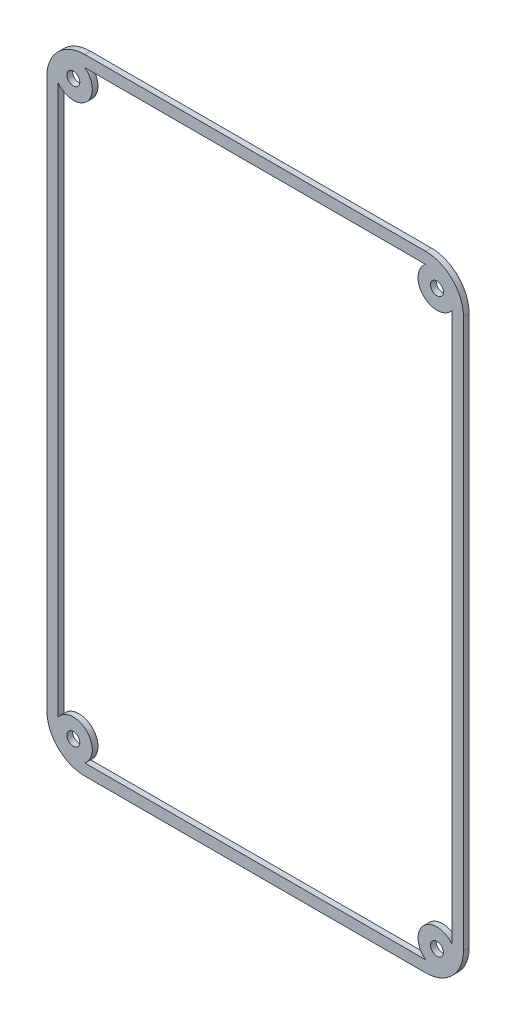
from build123d import *

# Parameters (mm, degrees)
BOSS_EXTRUDE1_DEPTH = 1.5
SKETCH2_R           = 5
BOSS_EXTRUDE2_DEPTH = 1.5
SKETCH3_R           = 1.7
CUT_EXTRUDE1_DEPTH  = 100.164005567


with BuildPart() as part:
    # Sketch1 → Boss-Extrude1 (new body)
    with BuildSketch(Plane.XY):
        with BuildLine():
            Line((-45, -82.5), (45, -82.5))
            ThreePointArc((45, -82.5), (52.071067812, -79.571067812), (55, -72.5))
            Line((55, -72.5), (55, 72.5))
            ThreePointArc((55, 72.5), (52.071067812, 79.571067812), (45, 82.5))
            Line((45, 82.5), (-45, 82.5))
            ThreePointArc((-45, 82.5), (-52.071067812, 79.571067812), (-55, 72.5))
            Line((-55, 72.5), (-55, -72.5))
            ThreePointArc((-55, -72.5), (-52.071067812, -79.571067812), (-45, -82.5))
        make_face()
        with BuildLine():
            Line((-45, -79.5), (45, -79.5))
            ThreePointArc((45, -79.5), (49.949747468, -77.449747468), (52, -72.5))
            Line((52, -72.5), (52, 72.5))
            ThreePointArc((52, 72.5), (49.949747468, 77.449747468), (45, 79.5))
            Line((45, 79.5), (-45, 79.5))
            ThreePointArc((-45, 79.5), (-49.949747468, 77.449747468), (-52, 72.5))
            Line((-52, 72.5), (-52, -72.5))
            ThreePointArc((-52, -72.5), (-49.949747468, -77.449747468), (-45, -79.5))
        make_face(mode=Mode.SUBTRACT)
    extrude(amount=BOSS_EXTRUDE1_DEPTH)

    # Sketch2 → Boss-Extrude2 (add)
    with BuildSketch(Plane.XY):
        with Locations((-48, -75.5)):
            Circle(SKETCH2_R)
        with Locations((-48, 75.5)):
            Circle(SKETCH2_R)
        with Locations((48, -75.5)):
            Circle(SKETCH2_R)
        with Locations((48, 75.5)):
            Circle(SKETCH2_R)
    extrude(amount=BOSS_EXTRUDE2_DEPTH)

    # Sketch3 → Cut-Extrude1 (cut, through all)
    with BuildSketch(Plane.XY.offset(1.5)):
        with Locations((-48, -75.5)):
            Circle(SKETCH3_R)
        with Locations((-48, 75.5)):
            Circle(SKETCH3_R)
        with Locations((48, -75.5)):
            Circle(SKETCH3_R)
        with Locations((48, 75.5)):
            Circle(SKETCH3_R)
    extrude(amount=-CUT_EXTRUDE1_DEPTH, mode=Mode.SUBTRACT)


solid = part.part
